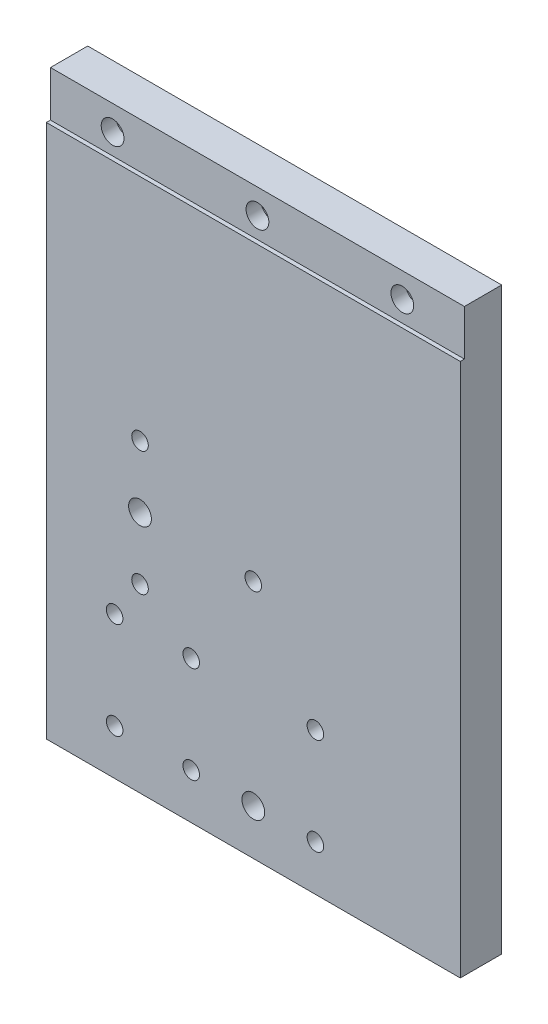
from build123d import *

# Parameters (mm, degrees)
SKIZZE1_W                                            = 100
SKIZZE1_H                                            = 140
AUFSATZ_LINEAR_AUSTRAGEN1_DEPTH                      = 10
STIRNSENKUNG_F_R_M5_ZYLINDERSCHRAUBE_MIT_D           = 5.5
STIRNSENKUNG_F_R_M5_ZYLINDERSCHRAUBE_MIT_CBORE_D     = 10
STIRNSENKUNG_F_R_M5_ZYLINDERSCHRAUBE_MIT_CBORE_DEPTH = 5.4
SKIZZE8_W                                            = 100
SKIZZE8_H                                            = 11
SCHNITT_LINEAR_AUSTRAGEN1_DEPTH                      = 1
STIRNSENKUNG_F_R_M5_ZYLINDERSCHRAUBE_2_D             = 5.5
STIRNSENKUNG_F_R_M5_ZYLINDERSCHRAUBE_2_CBORE_D       = 10
STIRNSENKUNG_F_R_M5_ZYLINDERSCHRAUBE_2_CBORE_DEPTH   = 5.4
F_4_0_4_DURCHMESSER_BOHRUNG1_D                       = 4
F_4_0_4_DURCHMESSER_BOHRUNG2_D                       = 4
F_4_0_4_DURCHMESSER_BOHRUNG3_D                       = 4
F_4_0_4_DURCHMESSER_BOHRUNG4_D                       = 4


with BuildPart() as part:
    # Skizze1 → Aufsatz-Linear austragen1 (new body)
    with BuildSketch(Plane.XY):
        Rectangle(SKIZZE1_W, SKIZZE1_H)
    extrude(amount=AUFSATZ_LINEAR_AUSTRAGEN1_DEPTH)

    # Stirnsenkung f_r M5 Zylinderschraube mit (through all)
    with Locations(Plane(origin=(0, 0, 0), x_dir=(-1, 0, 0), z_dir=(0, 0, -1))):
        with Locations((0, 64), (35, 64), (-35, 64)):
            CounterBoreHole(STIRNSENKUNG_F_R_M5_ZYLINDERSCHRAUBE_MIT_D / 2, STIRNSENKUNG_F_R_M5_ZYLINDERSCHRAUBE_MIT_CBORE_D / 2, STIRNSENKUNG_F_R_M5_ZYLINDERSCHRAUBE_MIT_CBORE_DEPTH)

    # Skizze8 → Schnitt-Linear austragen1 (cut)
    with BuildSketch(Plane.XY.offset(10)):
        with Locations((0, 64.5)):
            Rectangle(SKIZZE8_W, SKIZZE8_H)
    extrude(amount=-SCHNITT_LINEAR_AUSTRAGEN1_DEPTH, mode=Mode.SUBTRACT)

    # Stirnsenkung f_r M5 Zylinderschraube 2 (through all)
    with Locations(Plane(origin=(0, 0, 0), x_dir=(-1, 0, 0), z_dir=(0, 0, -1))):
        with Locations((0, -59), (27.37, -11.28)):
            CounterBoreHole(STIRNSENKUNG_F_R_M5_ZYLINDERSCHRAUBE_2_D / 2, STIRNSENKUNG_F_R_M5_ZYLINDERSCHRAUBE_2_CBORE_D / 2, STIRNSENKUNG_F_R_M5_ZYLINDERSCHRAUBE_2_CBORE_DEPTH)

    # Ø4.0 (4) Durchmesser Bohrung1 (through all)
    with Locations(Plane(origin=(0, 0, 0), x_dir=(-1, 0, 0), z_dir=(0, 0, -1))):
        with Locations((15, -59), (-15, -59), (27.37, -26.28), (27.37, 3.72)):
            Hole(F_4_0_4_DURCHMESSER_BOHRUNG1_D / 2)

    # Ø4.0 (4) Durchmesser Bohrung2 (through all)
    with Locations(Plane(origin=(0, 0, 0), x_dir=(-1, 0, 0), z_dir=(0, 0, -1))):
        with Locations((15, -35.6), (-15, -35.6)):
            Hole(F_4_0_4_DURCHMESSER_BOHRUNG2_D / 2)

    # Ø4.0 (4) Durchmesser Bohrung3 (through all)
    with Locations(Plane.XY.offset(10)):
        with Locations((-33.5, -35.6), (-33.5, -59)):
            Hole(F_4_0_4_DURCHMESSER_BOHRUNG3_D / 2)

    # Ø4.0 (4) Durchmesser Bohrung4 (through all)
    with Locations(Plane.XY.offset(10)):
        with Locations((0, -12)):
            Hole(F_4_0_4_DURCHMESSER_BOHRUNG4_D / 2)


solid = part.part
